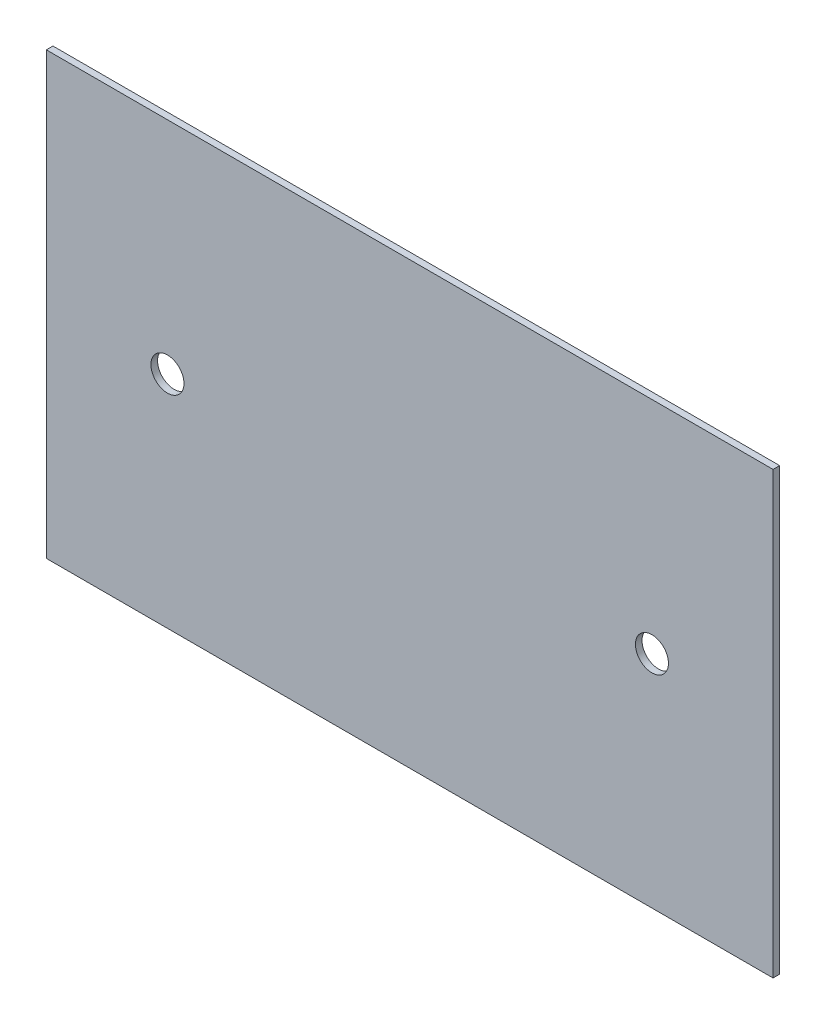
from build123d import *

# Parameters (mm, degrees)
CROQUIS1_W              = 330
CROQUIS1_H              = 200
SALIENTE_EXTRUIR1_DEPTH = 3
CROQUIS2_R              = 7.5
CORTAR_EXTRUIR1_DEPTH   = 193.961135983


with BuildPart() as part:
    # Croquis1 → Saliente-Extruir1 (new body)
    with BuildSketch(Plane.XY):
        Rectangle(CROQUIS1_W, CROQUIS1_H)
    extrude(amount=SALIENTE_EXTRUIR1_DEPTH)

    # Croquis2 → Cortar-Extruir1 (cut, through all)
    with BuildSketch(Plane.XY.offset(3)):
        with Locations((-110, 0)):
            Circle(CROQUIS2_R)
        with Locations(Location((110, 0, 0), (0, 0, 180))):
            Circle(CROQUIS2_R)
    extrude(amount=-CORTAR_EXTRUIR1_DEPTH, mode=Mode.SUBTRACT)


solid = part.part
